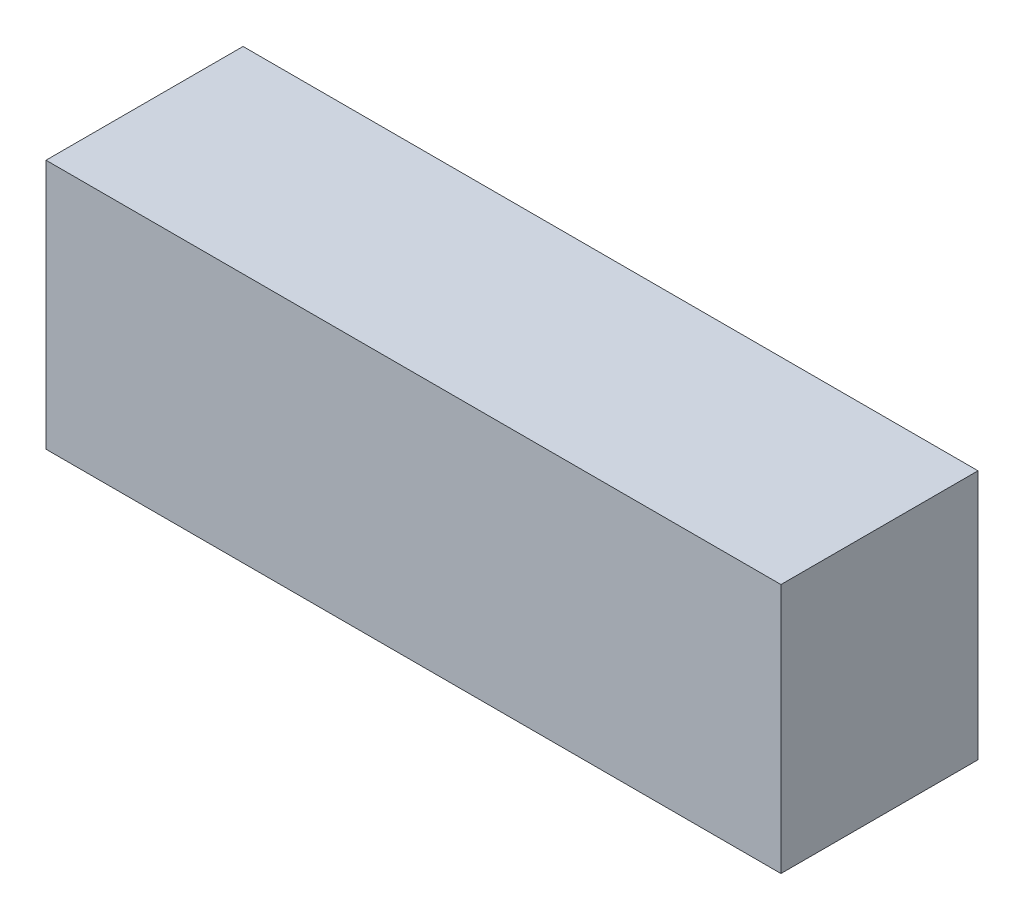
from build123d import *

# Parameters (mm, degrees)
SKETCH1_W           = 138
SKETCH1_H           = 47
BOSS_EXTRUDE1_DEPTH = 37


with BuildPart() as part:
    # Sketch1 → Boss-Extrude1 (new body)
    with BuildSketch(Plane.XY):
        with Locations((69, 23.5)):
            Rectangle(SKETCH1_W, SKETCH1_H)
    extrude(amount=BOSS_EXTRUDE1_DEPTH)


solid = part.part
